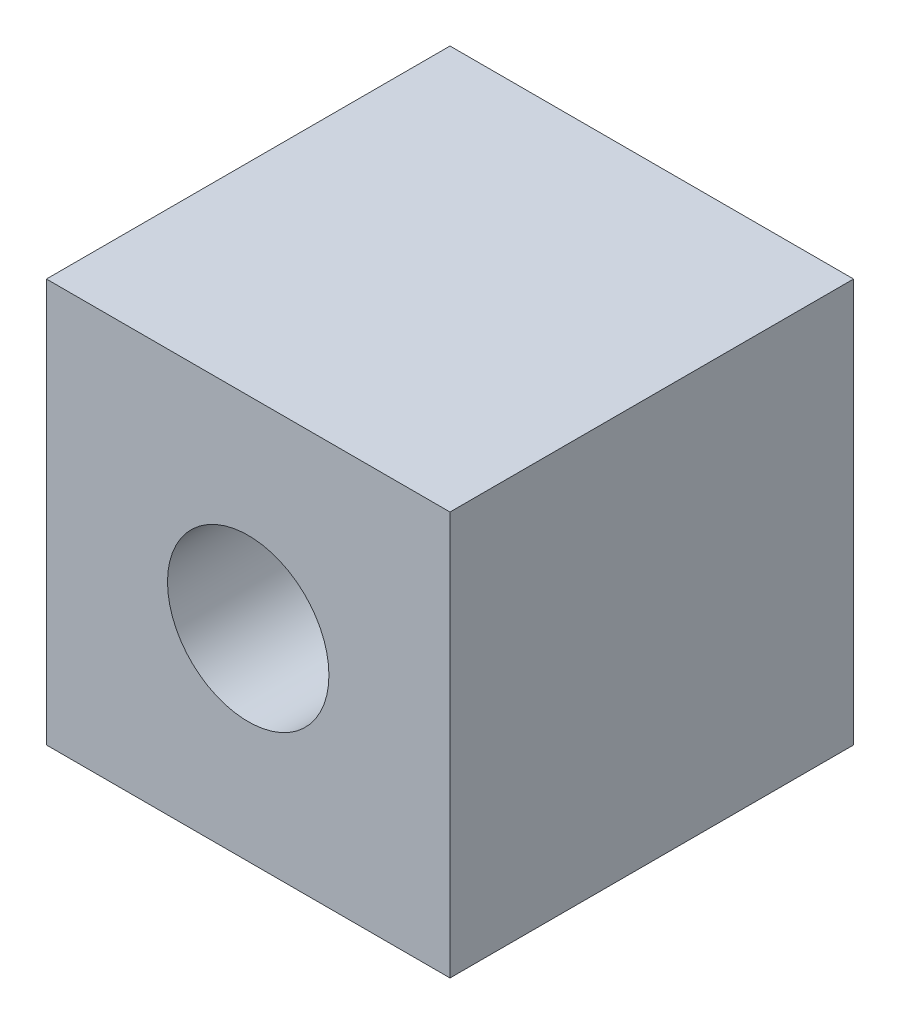
from build123d import *

# Parameters (mm, degrees)
SKETCH1_W           = 50
SKETCH1_H           = 50
BOSS_EXTRUDE1_DEPTH = 50
SKETCH2_R           = 10
CUT_EXTRUDE1_DEPTH  = 50


with BuildPart() as part:
    # Sketch1 → Boss-Extrude1 (new body)
    with BuildSketch(Plane.XY):
        Rectangle(SKETCH1_W, SKETCH1_H)
    extrude(amount=BOSS_EXTRUDE1_DEPTH)

    # Sketch2 → Cut-Extrude1 (cut)
    with BuildSketch(Plane.XY.offset(50)):
        Circle(SKETCH2_R)
    extrude(amount=-CUT_EXTRUDE1_DEPTH, mode=Mode.SUBTRACT)


solid = part.part
